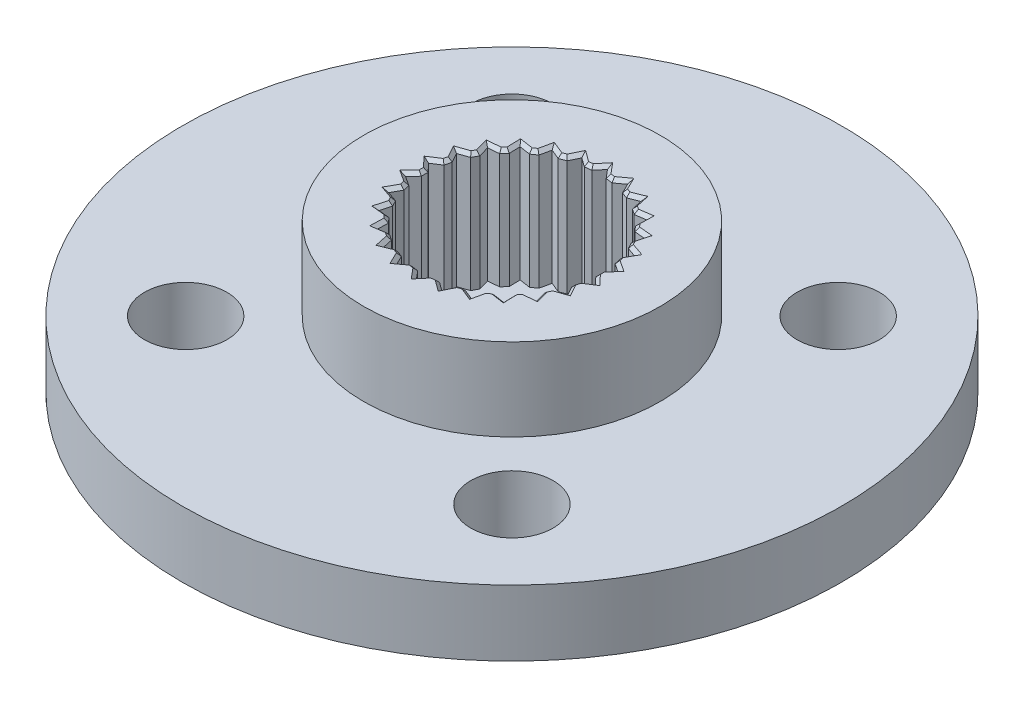
from build123d import *

# Parameters (mm, degrees)
SKETCH1_R           = 10
SKETCH1_R_2         = 1.25
SKETCH1_R_3         = 1.5
BOSS_EXTRUDE1_DEPTH = 2
SKETCH2_R           = 4.5
SKETCH2_R_2         = 1.5
BOSS_EXTRUDE2_DEPTH = 2.5
SKETCH3_R           = 2.25
CUT_EXTRUDE1_DEPTH  = 3.6
CUT_EXTRUDE2_DEPTH  = 3.6
CHAMFER1_SIZE       = 0.1


with BuildPart() as part:
    # Sketch1 → Boss-Extrude1 (new body)
    with BuildSketch(Plane(origin=(0, 0, 0), x_dir=(1, 0, 0), z_dir=(0, 1, 0))):
        with Locations(Location((0, 0, 0), (0, 0, 270))):
            Circle(SKETCH1_R)
        with Locations(Location((-4.949747468, 4.949747468, 0), (0, 0, 270))):
            Circle(SKETCH1_R_2, mode=Mode.SUBTRACT)
        with Locations(Location((4.949747468, 4.949747468, 0), (0, 0, 270))):
            Circle(SKETCH1_R_2, mode=Mode.SUBTRACT)
        with Locations(Location((4.949747468, -4.949747468, 0), (0, 0, 270))):
            Circle(SKETCH1_R_2, mode=Mode.SUBTRACT)
        with Locations(Location((-4.949747468, -4.949747468, 0), (0, 0, 270))):
            Circle(SKETCH1_R_2, mode=Mode.SUBTRACT)
        with Locations(Location((0, 0, 0), (0, 0, 270))):
            Circle(SKETCH1_R_3, mode=Mode.SUBTRACT)
    extrude(amount=BOSS_EXTRUDE1_DEPTH)

    # Sketch2 → Boss-Extrude2 (add)
    with BuildSketch(Plane(origin=(0, 2, 0), x_dir=(1, 0, 0), z_dir=(0, 1, 0))):
        with Locations(Location((0, 0, 0), (0, 0, 270))):
            Circle(SKETCH2_R)
        with Locations(Location((0, 0, 0), (0, 0, 270))):
            Circle(SKETCH2_R_2, mode=Mode.SUBTRACT)
    extrude(amount=BOSS_EXTRUDE2_DEPTH)

    # Sketch3 → Cut-Extrude1 (cut)
    with BuildSketch(Plane(origin=(0, 4.5, 0), x_dir=(1, 0, 0), z_dir=(0, 1, 0))):
        with Locations(Location((0, 0, 0), (0, 0, 270))):
            Circle(SKETCH3_R)
    extrude(amount=-CUT_EXTRUDE1_DEPTH, mode=Mode.SUBTRACT)

    # Sketch7 → Cut-Extrude2 (cut)
    with BuildSketch(Plane(origin=(0, 4.5, 0), x_dir=(1, 0, 0), z_dir=(0, 1, 0))):
        Polygon((-0.842998944, 2.512340101), (-1.034995876, 2.439525269), (-1.129082655, 2.478127827), (-1.347697199, 2.567822474), (-1.398067166, 2.336953865), (-1.419745267, 2.237593211), (-1.588737387, 2.120946373), (-1.689328372, 2.13591077), (-1.923055709, 2.17068117), (-1.916711542, 1.93446686), (-1.913981155, 1.832805537), (-2.050147256, 1.679105783), (-2.151396465, 1.669562343), (-2.386653211, 1.647387766), (-2.32396361, 1.419555673), (-2.296983416, 1.321501868), (-2.392410018, 1.139681668), (-2.488433215, 1.106185022), (-2.711547104, 1.028354172), (-2.59615536, 0.82214507), (-2.54649335, 0.733397313), (-2.595634607, 0.534023397), (-2.680851271, 0.478520248), (-2.878855735, 0.349556373), (-2.717467997, 0.176954384), (-2.648010346, 0.102670372), (-2.648010346, -0.102670372), (-2.717467997, -0.176954384), (-2.878855735, -0.349556373), (-2.680851271, -0.478520248), (-2.595634607, -0.534023397), (-2.54649335, -0.733397313), (-2.59615536, -0.82214507), (-2.711547104, -1.028354172), (-2.488433215, -1.106185022), (-2.392410018, -1.139681668), (-2.296983416, -1.321501868), (-2.32396361, -1.419555673), (-2.386653211, -1.647387766), (-2.151396465, -1.669562343), (-2.050147256, -1.679105783), (-1.913981155, -1.832805537), (-1.916711542, -1.93446686), (-1.923055709, -2.17068117), (-1.689328372, -2.13591077), (-1.588737387, -2.120946373), (-1.419745267, -2.237593211), (-1.398067166, -2.336953865), (-1.347697199, -2.567822474), (-1.129082655, -2.478127827), (-1.034995876, -2.439525269), (-0.842998944, -2.512340101), (-0.798172209, -2.603625605), (-0.694015426, -2.815731271), (-0.503218758, -2.676325101), (-0.421104166, -2.616327824), (-0.217260587, -2.641078915), (-0.151890384, -2.718984089), (0, -2.9), (0.151890384, -2.718984089), (0.217260587, -2.641078915), (0.421104166, -2.616327824), (0.503218758, -2.676325101), (0.694015426, -2.815731271), (0.798172209, -2.603625605), (0.842998944, -2.512340101), (1.034995876, -2.439525269), (1.129082655, -2.478127827), (1.347697199, -2.567822474), (1.398067166, -2.336953865), (1.419745267, -2.237593211), (1.588737387, -2.120946373), (1.689328372, -2.13591077), (1.923055709, -2.17068117), (1.916711542, -1.93446686), (1.913981155, -1.832805537), (2.050147256, -1.679105783), (2.151396465, -1.669562343), (2.386653211, -1.647387766), (2.32396361, -1.419555673), (2.296983416, -1.321501868), (2.392410018, -1.139681668), (2.488433215, -1.106185022), (2.711547104, -1.028354172), (2.59615536, -0.82214507), (2.54649335, -0.733397313), (2.595634607, -0.534023397), (2.680851271, -0.478520248), (2.878855735, -0.349556373), (2.717467997, -0.176954384), (2.648010346, -0.102670372), (2.648010346, 0.102670372), (2.717467997, 0.176954384), (2.878855735, 0.349556373), (2.680851271, 0.478520248), (2.595634607, 0.534023397), (2.54649335, 0.733397313), (2.59615536, 0.82214507), (2.711547104, 1.028354172), (2.488433215, 1.106185022), (2.392410018, 1.139681668), (2.296983416, 1.321501868), (2.32396361, 1.419555673), (2.386653211, 1.647387766), (2.151396465, 1.669562343), (2.050147256, 1.679105783), (1.913981155, 1.832805537), (1.916711542, 1.93446686), (1.923055709, 2.17068117), (1.689328372, 2.13591077), (1.588737387, 2.120946373), (1.419745267, 2.237593211), (1.398067166, 2.336953865), (1.347697199, 2.567822474), (1.129082655, 2.478127827), (1.034995876, 2.439525269), (0.842998944, 2.512340101), (0.798172209, 2.603625605), (0.694015426, 2.815731271), (0.503218758, 2.676325101), (0.421104166, 2.616327824), (0.217260587, 2.641078915), (0.151890384, 2.718984089), (0, 2.9), (-0.151890384, 2.718984089), (-0.217260587, 2.641078915), (-0.421104166, 2.616327824), (-0.503218758, 2.676325101), (-0.694015426, 2.815731271), (-0.798172209, 2.603625605), align=None)
    extrude(amount=-CUT_EXTRUDE2_DEPTH, mode=Mode.SUBTRACT)

    # Chamfer1
    chamfer1_edges = [part.edges().sort_by_distance(p)[0] for p in [
        (-1.982064206, 4.5, 1.75595566),
        (-1.918518432, 4.5, 2.001743353),
        (-1.755896548, 4.5, 2.145813771),
        (-1.504241327, 4.5, 2.179269792),
        (-1.383721233, 4.5, 2.402707843),
        (-1.191346537, 4.5, 2.503673872),
        (-0.93899741, 4.5, 2.475932685),
        (-0.768507185, 4.5, 2.664035686),
        (-0.557559796, 4.5, 2.716029547),
        (-0.319182376, 4.5, 2.62870337),
        (-0.108630293, 4.5, 2.770539458),
        (0.108630293, 4.5, 2.770539458),
        (0.319182376, 4.5, 2.62870337),
        (0.557559796, 4.5, 2.716029547),
        (0.768507185, 4.5, 2.664035686),
        (0.93899741, 4.5, 2.475932685),
        (1.191346537, 4.5, 2.503673872),
        (1.383721233, 4.5, 2.402707843),
        (1.504241327, 4.5, 2.179269792),
        (1.755896548, 4.5, 2.145813771),
        (1.918518432, 4.5, 2.001743353),
        (1.982064206, 4.5, 1.75595566),
        (2.218400233, 4.5, 1.663246774),
        (2.341818314, 4.5, 1.484444817),
        (2.344696717, 4.5, 1.230591768),
        (2.551978561, 4.5, 1.08401792),
        (2.629020227, 4.5, 0.880875743),
        (2.571063978, 4.5, 0.633710355),
        (2.737245171, 4.5, 0.441789885),
        (2.763433041, 4.5, 0.226113373),
        (2.648010346, 4.5, 0),
        (2.763433041, 4.5, -0.226113373),
        (2.737245171, 4.5, -0.441789885),
        (2.571063978, 4.5, -0.633710355),
        (2.629020227, 4.5, -0.880875743),
        (2.551978561, 4.5, -1.08401792),
        (2.344696717, 4.5, -1.230591768),
        (2.341818314, 4.5, -1.484444817),
        (2.218400233, 4.5, -1.663246774),
        (1.982064206, 4.5, -1.75595566),
        (1.918518432, 4.5, -2.001743353),
        (1.755896548, 4.5, -2.145813771),
        (1.504241327, 4.5, -2.179269792),
        (1.383721233, 4.5, -2.402707843),
        (1.191346537, 4.5, -2.503673872),
        (0.93899741, 4.5, -2.475932685),
        (0.768507185, 4.5, -2.664035686),
        (0.557559796, 4.5, -2.716029547),
        (0.319182376, 4.5, -2.62870337),
        (0.108630293, 4.5, -2.770539458),
        (-0.108630293, 4.5, -2.770539458),
        (-0.319182376, 4.5, -2.62870337),
        (-0.557559796, 4.5, -2.716029547),
        (-0.768507185, 4.5, -2.664035686),
        (-0.93899741, 4.5, -2.475932685),
        (-1.191346537, 4.5, -2.503673872),
        (-1.383721233, 4.5, -2.402707843),
        (-1.504241327, 4.5, -2.179269792),
        (-1.755896548, 4.5, -2.145813771),
        (-1.918518432, 4.5, -2.001743353),
        (-1.982064206, 4.5, -1.75595566),
        (-2.218400233, 4.5, -1.663246774),
        (-2.341818314, 4.5, -1.484444817),
        (-2.344696717, 4.5, -1.230591768),
        (-2.551978561, 4.5, -1.08401792),
        (-2.629020227, 4.5, -0.880875743),
        (-2.571063978, 4.5, -0.633710355),
        (-2.737245171, 4.5, -0.441789885),
        (-2.763433041, 4.5, -0.226113373),
        (-2.648010346, 4.5, 0),
        (-2.763433041, 4.5, 0.226113373),
        (-2.737245171, 4.5, 0.441789885),
        (-2.571063978, 4.5, 0.633710355),
        (-2.629020227, 4.5, 0.880875743),
        (-2.551978561, 4.5, 1.08401792),
        (-2.344696717, 4.5, 1.230591768),
        (-2.341818314, 4.5, 1.484444817),
        (-2.218400233, 4.5, 1.663246774),
    ]]
    chamfer(chamfer1_edges, length=CHAMFER1_SIZE)


solid = part.part
